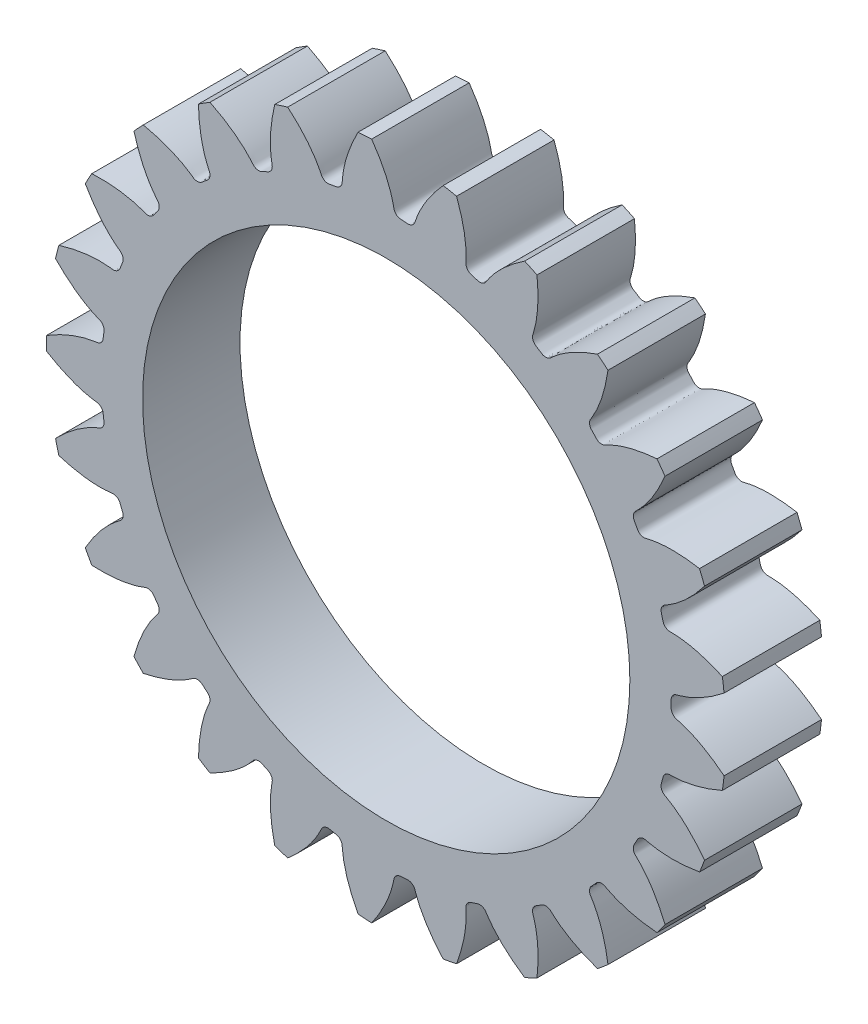
from build123d import *

# Parameters (mm, degrees)
SKETCHREVOLVESPURGEAR_W       = 4
SKETCHREVOLVESPURGEAR_H       = 13.943547629
TOOTHEXTRUDECUTSPURGEAR_DEPTH = 2
PATTERNSPURGEAR_COUNT         = 25
BOREREVOLVESKETCH_W           = 4
BOREREVOLVESKETCH_H           = 10


with BuildPart() as part:
    # SketchRevolveSpurGear → SpurGear (revolve)
    with BuildSketch(Plane(origin=(0, 0, 0), x_dir=(0, 0, -1), z_dir=(1, 0, 0))):
        with Locations((0, 6.971773815)):
            Rectangle(SKETCHREVOLVESPURGEAR_W, SKETCHREVOLVESPURGEAR_H)
    revolve(axis=Axis((0, 0, 0), (0, 0, -1)))

    # SketchToothSpurGear → ToothExtrudeCutSpurGear (cut, symmetric)
    with BuildSketch(Plane.XY):
        with BuildLine():
            ThreePointArc((13.932658001, 1.523676099), (14.01572502, 0), (13.932658001, -1.523676099))
            add(Edge.make_bspline(
                [(13.932658001, -1.523676099), (13.843271458, -1.450505415), (13.70926332, -1.345774423), (13.529229421, -1.215211767), (13.399956603, -1.126020687), (13.274053098, -1.04345237), (13.151755831, -0.967297206), (13.033293688, -0.897338098), (12.918887294, -0.833350832), (12.808748819, -0.775104283), (12.703081743, -0.722360831), (12.602080779, -0.674876183), (12.505931298, -0.632401221), (12.414810491, -0.594676966), (12.328882682, -0.561452933), (12.248314385, -0.532426628), (12.17322332, -0.507447007), (12.061252254, -0.472577353), (11.956796138, -0.448533782), (11.86301481, -0.415541634), (11.820783831, -0.390659426), (11.782966954, -0.359649494), (11.750721679, -0.322825391), (11.724820573, -0.281293389), (11.706098712, -0.236113543), (11.694520374, -0.188484365), (11.691011209, -0.109293784), (11.695428174, 0), (11.691011209, 0.109293784), (11.694520374, 0.188484365), (11.706098712, 0.236113543), (11.724820573, 0.281293389), (11.750721679, 0.322825391), (11.782966954, 0.359649494), (11.820783831, 0.390659426), (11.86301481, 0.415541634), (11.956796138, 0.448533782), (12.061252254, 0.472577353), (12.17322332, 0.507447007), (12.248314385, 0.532426628), (12.328882682, 0.561452933), (12.414810491, 0.594676966), (12.505931298, 0.632401221), (12.602080779, 0.674876183), (12.703081743, 0.722360831), (12.808748819, 0.775104283), (12.918887294, 0.833350832), (13.033293688, 0.897338098), (13.151755831, 0.967297206), (13.274053098, 1.04345237), (13.399956603, 1.126020687), (13.529229421, 1.215211767), (13.70926332, 1.345774423), (13.843271458, 1.450505415), (13.932658001, 1.523676099)],
                knots=[0, 0, 0, 0, 0.060855059, 0.089572493, 0.117149863, 0.143587169, 0.168884412, 0.19304159, 0.216058705, 0.237935756, 0.258672743, 0.278269666, 0.296726526, 0.314043322, 0.330220053, 0.345256721, 0.359153326, 0.371909866, 0.407022306, 0.415578365, 0.424134424, 0.432690483, 0.441246542, 0.449802601, 0.45835866, 0.466914719, 0.475470778, 0.5, 0.524529222, 0.533085281, 0.54164134, 0.550197399, 0.558753458, 0.567309517, 0.575865576, 0.584421635, 0.592977694, 0.628090134, 0.640846674, 0.654743279, 0.669779947, 0.685956678, 0.703273474, 0.721730334, 0.741327257, 0.762064244, 0.783941295, 0.80695841, 0.831115588, 0.856412831, 0.882850137, 0.910427507, 0.939144941, 1, 1, 1, 1], degree=3))
        make_face()
    toothextrudecutspurgear = extrude(amount=TOOTHEXTRUDECUTSPURGEAR_DEPTH, both=True, mode=Mode.SUBTRACT)

    # PatternSpurGear: ToothExtrudeCutSpurGear ×25 about axis
    patternspurgear_axis = Axis((0, 0, 55), (0, 0, -1))
    for i in range(1, PATTERNSPURGEAR_COUNT):
        add(toothextrudecutspurgear.rotate(patternspurgear_axis, i * 360 / PATTERNSPURGEAR_COUNT), mode=Mode.SUBTRACT)

    # BoreRevolveSketch → BoreRevolveCut (revolve, cut)
    with BuildSketch(Plane(origin=(0, 0, 0), x_dir=(0, 0, -1), z_dir=(1, 0, 0))):
        with Locations((0, 5)):
            Rectangle(BOREREVOLVESKETCH_W, BOREREVOLVESKETCH_H)
    revolve(axis=Axis((0, 0, 0), (0, 0, -1)), mode=Mode.SUBTRACT)


solid = part.part
